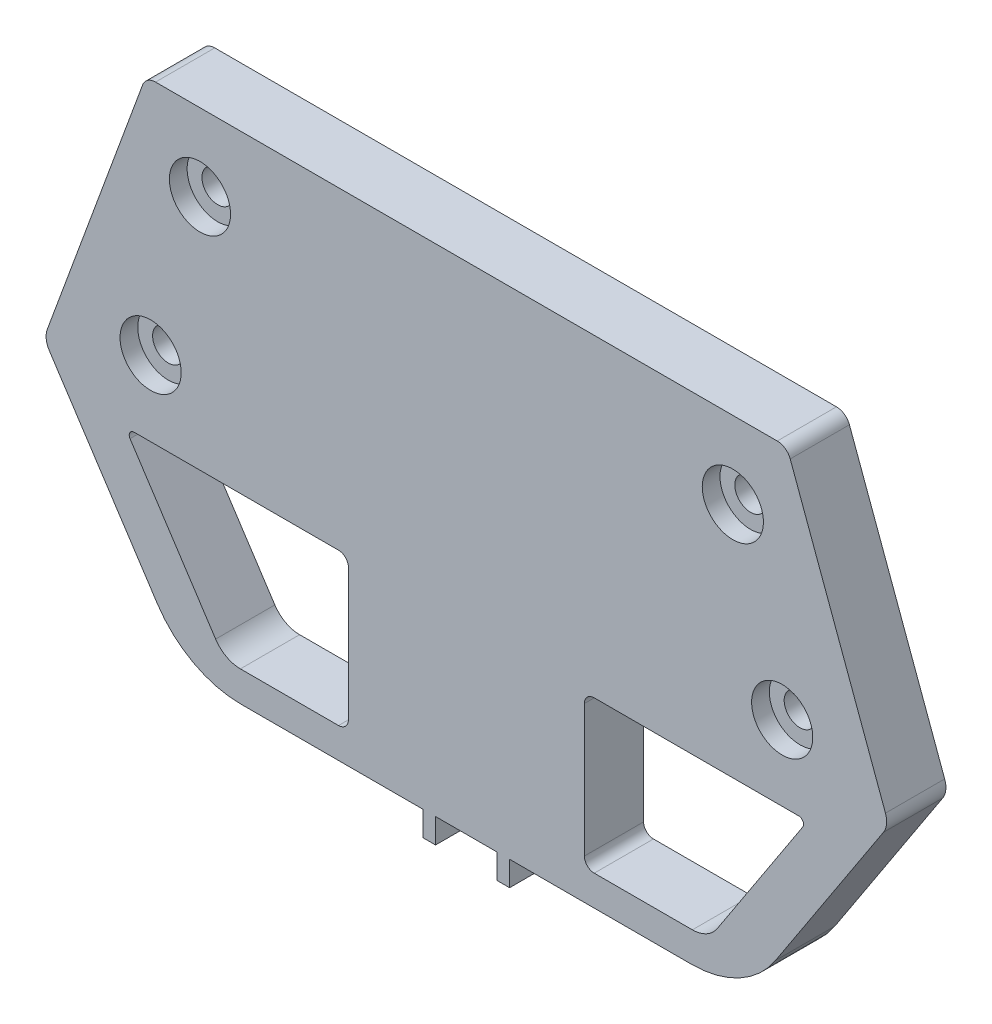
from build123d import *

# Parameters (mm, degrees)
BOSS_EXTRUDE1_DEPTH = 7.62
CUT_EXTRUDE4_DEPTH  = 65.443482206
SKETCH8_R           = 2.032
CUT_EXTRUDE6_DEPTH  = 65.443482206
SKETCH9_R           = 2.032
CUT_EXTRUDE7_DEPTH  = 25.4
SKETCH11_R          = 3.937
CUT_EXTRUDE9_DEPTH  = 2.286
SKETCH12_W          = 1.5875
SKETCH12_H          = 3.175
BOSS_EXTRUDE2_DEPTH = 7.62


with BuildPart() as part:
    # Sketch2 → Boss-Extrude1 (new body)
    with BuildSketch(Plane.XY):
        with BuildLine():
            Line((-53.9331315, -0.315391151), (-41.673792668, 33.030010472))
            ThreePointArc((-41.673792668, 33.030010472), (-41.022456018, 33.874587748), (-40.005, 34.194483756))
            Line((-40.005, 34.194483756), (40.005, 34.194483756))
            ThreePointArc((40.005, 34.194483756), (41.022456018, 33.874587748), (41.673792668, 33.030010472))
            Line((41.673792668, 33.030010472), (53.9331315, -0.315391151))
            ThreePointArc((53.9331315, -0.315391151), (54.072783991, -1.479661595), (53.674573059, -2.582592481))
            Line((53.674573059, -2.582592481), (39.780650937, -23.816388011))
            ThreePointArc((39.780650937, -23.816388011), (35.127277075, -28.095614939), (28.998611748, -29.64646397))
            Line((28.998611748, -29.64646397), (-28.998611748, -29.64646397))
            ThreePointArc((-28.998611748, -29.64646397), (-35.127277075, -28.095614939), (-39.780650937, -23.816388011))
            Line((-39.780650937, -23.816388011), (-53.674573059, -2.582592481))
            ThreePointArc((-53.674573059, -2.582592481), (-54.072783991, -1.479661595), (-53.9331315, -0.315391151))
        make_face()
    extrude(amount=BOSS_EXTRUDE1_DEPTH)

    # Sketch6 → Cut-Extrude4 (cut, through all)
    with BuildSketch(Plane.XY.offset(7.62)):
        with BuildLine():
            Line((-43.288518763, -7.189330581), (-32.273407011, -24.02349941))
            ThreePointArc((-32.273407011, -24.02349941), (-30.897448537, -25.288826187), (-29.085260384, -25.747397522))
            Line((-29.085260384, -25.747397522), (-16.452977044, -25.747397522))
            ThreePointArc((-16.452977044, -25.747397522), (-15.554951432, -25.375423134), (-15.182977044, -24.477397522))
            Line((-15.182977044, -24.477397522), (-15.182977044, -7.476646933))
            ThreePointArc((-15.182977044, -7.476646933), (-15.554951432, -6.578621321), (-16.452977044, -6.206646933))
            Line((-16.452977044, -6.206646933), (-42.757160992, -6.206646933))
            ThreePointArc((-42.757160992, -6.206646933), (-43.315732436, -6.539615574), (-43.288518763, -7.189330581))
        make_face()
        with BuildLine():
            Line((43.288518763, -7.189330581), (32.273407011, -24.02349941))
            ThreePointArc((32.273407011, -24.02349941), (30.897448537, -25.288826187), (29.085260384, -25.747397522))
            Line((29.085260384, -25.747397522), (16.452977044, -25.747397522))
            ThreePointArc((16.452977044, -25.747397522), (15.554951432, -25.375423134), (15.182977044, -24.477397522))
            Line((15.182977044, -24.477397522), (15.182977044, -7.476646933))
            ThreePointArc((15.182977044, -7.476646933), (15.554951432, -6.578621321), (16.452977044, -6.206646933))
            Line((16.452977044, -6.206646933), (42.757160992, -6.206646933))
            ThreePointArc((42.757160992, -6.206646933), (43.315732436, -6.539615574), (43.288518763, -7.189330581))
        make_face()
    extrude(amount=-CUT_EXTRUDE4_DEPTH, mode=Mode.SUBTRACT)

    # Sketch8 → Cut-Extrude6 (cut, through all)
    with BuildSketch(Plane.XY.offset(7.62)):
        with Locations((-40.64, 3.445353067)):
            Circle(SKETCH8_R)
        with Locations((-34.29, 24.273353067)):
            Circle(SKETCH8_R)
        with Locations((40.64, 3.445353067)):
            Circle(SKETCH8_R)
        with Locations((34.29, 24.273353067)):
            Circle(SKETCH8_R)
    extrude(amount=-CUT_EXTRUDE6_DEPTH, mode=Mode.SUBTRACT)

    # Sketch9 → Cut-Extrude7 (cut)
    with BuildSketch(Plane.XZ.offset(29.64646397)):
        with Locations(Location((0, 3.81, 0), (0, 0, 270))):
            Circle(SKETCH9_R)
    extrude(amount=-CUT_EXTRUDE7_DEPTH, mode=Mode.SUBTRACT)

    # Sketch11 → Cut-Extrude9 (cut)
    with BuildSketch(Plane.XY.offset(7.62)):
        with Locations((-34.29, 24.273353067)):
            Circle(SKETCH11_R)
        with Locations((-40.64, 3.445353067)):
            Circle(SKETCH11_R)
        with Locations(Location((40.64, 3.445353067, 0), (0, 0, 180))):
            Circle(SKETCH11_R)
        with Locations(Location((34.29, 24.273353067, 0), (0, 0, 180))):
            Circle(SKETCH11_R)
    extrude(amount=-CUT_EXTRUDE9_DEPTH, mode=Mode.SUBTRACT)

    # Sketch12 → Boss-Extrude2 (add)
    with BuildSketch(Plane.XY.offset(7.62)):
        with Locations((-4.7625, -31.23396397)):
            Rectangle(SKETCH12_W, SKETCH12_H)
        with Locations((4.7625, -31.23396397)):
            Rectangle(SKETCH12_W, SKETCH12_H)
    extrude(amount=-BOSS_EXTRUDE2_DEPTH)


solid = part.part
